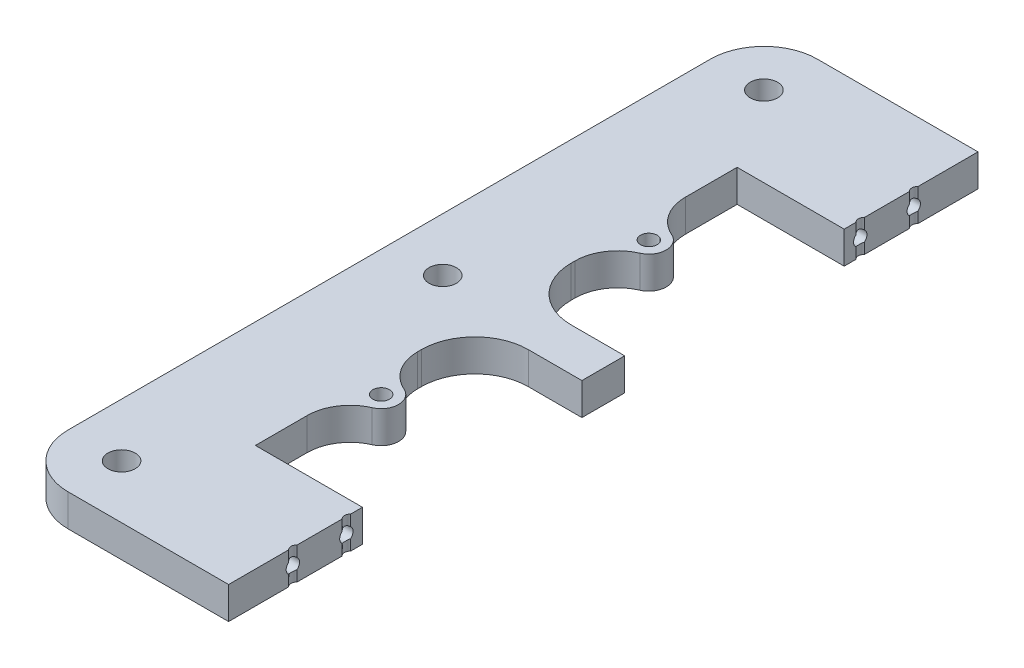
from build123d import *

# Parameters (mm, degrees)
EXTRUDE_1_DEPTH     = 6
SKETCH_2_R          = 1.25
CUT_EXTRUDE_1_DEPTH = 10
SKETCH_3_R          = 1.05
CUT_EXTRUDE_2_DEPTH = 81.845531726
SKETCH_4_R          = 2.55
CUT_EXTRUDE_3_DEPTH = 81.845531783
SKETCH_5_W          = 8
SKETCH_5_H          = 6
EXTRUDE_2_DEPTH     = 20
FILLET_2_R          = 10
FILLET_3_R          = 10
SKETCH_7_R          = 1.55
EXTRUDE_3_DEPTH     = 6
FILLET_4_R          = 8
SKETCH_9_W          = 9
SKETCH_9_H          = 6
EXTRUDE_4_DEPTH     = 3.5


with BuildPart() as part:
    # ｽｹｯﾁ1 → ﾎﾞｽ - 押し出し1 (new body)
    with BuildSketch(Plane(origin=(0, 0, 0), x_dir=(1, 0, 0), z_dir=(0, 1, 0))):
        Polygon((0, -70), (0, 70), (36.5, 70), (36.5, 61), (40, 61), (40, 45), (20, 45), (20, -45), (40, -45), (40, -61), (36.5, -61), (36.5, -70), align=None)
    extrude(amount=EXTRUDE_1_DEPTH)

    # ｽｹｯﾁ2 → ｶｯﾄ - 押し出し1 (cut)
    with BuildSketch(Plane(origin=(40, 0, 0), x_dir=(0, 0, -1), z_dir=(1, 0, 0))):
        with Locations((48, 3)):
            Circle(SKETCH_2_R)
        with Locations((58, 3)):
            Circle(SKETCH_2_R)
        with Locations(Location((-48, 3, 0), (0, 0, 180))):
            Circle(SKETCH_2_R)
        with Locations(Location((-58, 3, 0), (0, 0, 180))):
            Circle(SKETCH_2_R)
    extrude(amount=-CUT_EXTRUDE_1_DEPTH, mode=Mode.SUBTRACT)

    # ｽｹｯﾁ3 → ｶｯﾄ - 押し出し2 (cut, through all)
    with BuildSketch(Plane(origin=(0, 6, 0), x_dir=(1, 0, 0), z_dir=(0, 1, 0))):
        with Locations((40.7, 58)):
            Circle(SKETCH_3_R)
        with Locations((40.7, 48)):
            Circle(SKETCH_3_R)
        with Locations((40.7, -48)):
            Circle(SKETCH_3_R)
        with Locations((40.7, -58)):
            Circle(SKETCH_3_R)
    extrude(amount=-CUT_EXTRUDE_2_DEPTH, mode=Mode.SUBTRACT)

    # ｽｹｯﾁ4 → ｶｯﾄ - 押し出し3 (cut, through all)
    with BuildSketch(Plane(origin=(0, 6, 0), x_dir=(1, 0, 0), z_dir=(0, 1, 0))):
        with Locations(Location((10, 0, 0), (0, 0, 270))):
            Circle(SKETCH_4_R)
        with Locations(Location((10, 60, 0), (0, 0, 270))):
            Circle(SKETCH_4_R)
        with Locations(Location((10, -60, 0), (0, 0, 270))):
            Circle(SKETCH_4_R)
    extrude(amount=-CUT_EXTRUDE_3_DEPTH, mode=Mode.SUBTRACT)

    # ｽｹｯﾁ5 → ﾎﾞｽ - 押し出し2 (add)
    with BuildSketch(Plane(origin=(20, 0, 0), x_dir=(0, 0, -1), z_dir=(1, 0, 0))):
        with Locations((0, 3)):
            Rectangle(SKETCH_5_W, SKETCH_5_H)
    extrude(amount=EXTRUDE_2_DEPTH)

    # ﾌｨﾚｯﾄ2
    fillet_2_edges = [part.edges().sort_by_distance(p)[0] for p in [
        (20, 3, 4),
        (20, 3, -4),
    ]]
    fillet(fillet_2_edges, radius=FILLET_2_R)

    # ﾌｨﾚｯﾄ3
    fillet_3_edges = [part.edges().sort_by_distance(p)[0] for p in [
        (0, 3, 70),
        (0, 3, -70),
    ]]
    fillet(fillet_3_edges, radius=FILLET_3_R)

    # ｽｹｯﾁ7 → ﾎﾞｽ - 押し出し3 (add, through all)
    # profile 1 of 2: a face of its own
    with BuildSketch(Plane(origin=(0, 6, 0), x_dir=(1, 0, 0), z_dir=(0, 1, 0))):
        with BuildLine():
            Line((23.5, 28.25), (20, 28.25))
            Line((20, 28.25), (20, 21.75))
            Line((20, 21.75), (23.5, 21.75))
            ThreePointArc((23.5, 21.75), (26.75, 25), (23.5, 28.25))
        make_face()
        with Locations(Location((23.5, 25, 0), (0, 0, 270))):
            Circle(SKETCH_7_R, mode=Mode.SUBTRACT)
    # profile 2 of 2: a face of its own
    with BuildSketch(Plane(origin=(0, 6, 0), x_dir=(1, 0, 0), z_dir=(0, 1, 0))):
        with BuildLine():
            Line((20, -21.75), (23.5, -21.75))
            ThreePointArc((23.5, -21.75), (26.75, -25), (23.5, -28.25))
            Line((23.5, -28.25), (20, -28.25))
            Line((20, -28.25), (20, -21.75))
        make_face()
        with Locations(Location((23.5, -25, 0), (0, 0, 90))):
            Circle(SKETCH_7_R, mode=Mode.SUBTRACT)
    extrude(amount=-EXTRUDE_3_DEPTH)

    # ﾌｨﾚｯﾄ4
    fillet_4_edges = [part.edges().sort_by_distance(p)[0] for p in [
        (20, 3, 28.25),
        (20, 3, 21.75),
        (20, 3, -28.25),
        (20, 3, -21.75),
    ]]
    fillet(fillet_4_edges, radius=FILLET_4_R)

    # ｽｹｯﾁ9 → ﾎﾞｽ - 押し出し4 (add)
    with BuildSketch(Plane(origin=(36.5, 0, 0), x_dir=(0, 0, -1), z_dir=(1, 0, 0))):
        with Locations((-65.5, 3)):
            Rectangle(SKETCH_9_W, SKETCH_9_H)
        with Locations((65.5, 3)):
            Rectangle(SKETCH_9_W, SKETCH_9_H)
    extrude(amount=EXTRUDE_4_DEPTH)


solid = part.part
